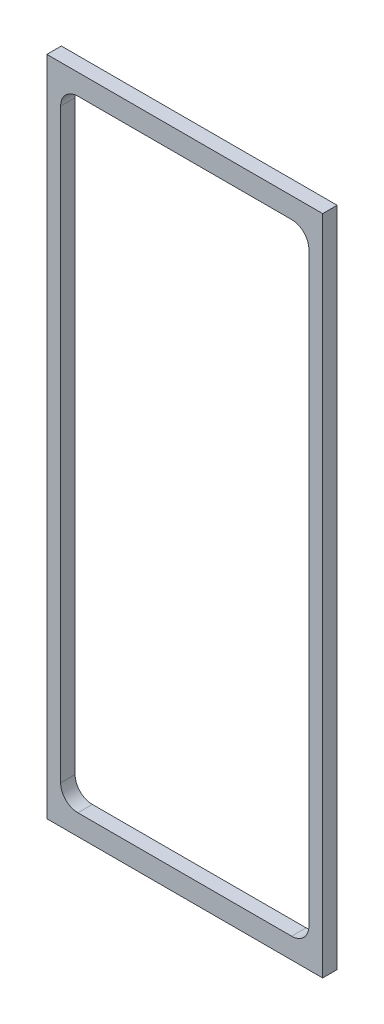
from build123d import *

# Parameters (mm, degrees)
SKETCH1_W           = 50.8
SKETCH1_H           = 121.92
BOSS_EXTRUDE1_DEPTH = 2.667
CUT_EXTRUDE1_DEPTH  = 67.093830945


with BuildPart() as part:
    # Sketch1 → Boss-Extrude1 (new body)
    with BuildSketch(Plane.XY):
        Rectangle(SKETCH1_W, SKETCH1_H)
    extrude(amount=BOSS_EXTRUDE1_DEPTH)

    # Sketch2 → Cut-Extrude1 (cut, through all)
    with BuildSketch(Plane.XY.offset(2.667)):
        with BuildLine():
            Line((19.685, -57.15), (-19.685, -57.15))
            ThreePointArc((-19.685, -57.15), (-21.93006403, -56.22006403), (-22.86, -53.975))
            Line((-22.86, -53.975), (-22.86, 53.975))
            ThreePointArc((-22.86, 53.975), (-21.93006403, 56.22006403), (-19.685, 57.15))
            Line((-19.685, 57.15), (19.685, 57.15))
            ThreePointArc((19.685, 57.15), (21.93006403, 56.22006403), (22.86, 53.975))
            Line((22.86, 53.975), (22.86, -53.975))
            ThreePointArc((22.86, -53.975), (21.93006403, -56.22006403), (19.685, -57.15))
        make_face()
    extrude(amount=-CUT_EXTRUDE1_DEPTH, mode=Mode.SUBTRACT)


solid = part.part
